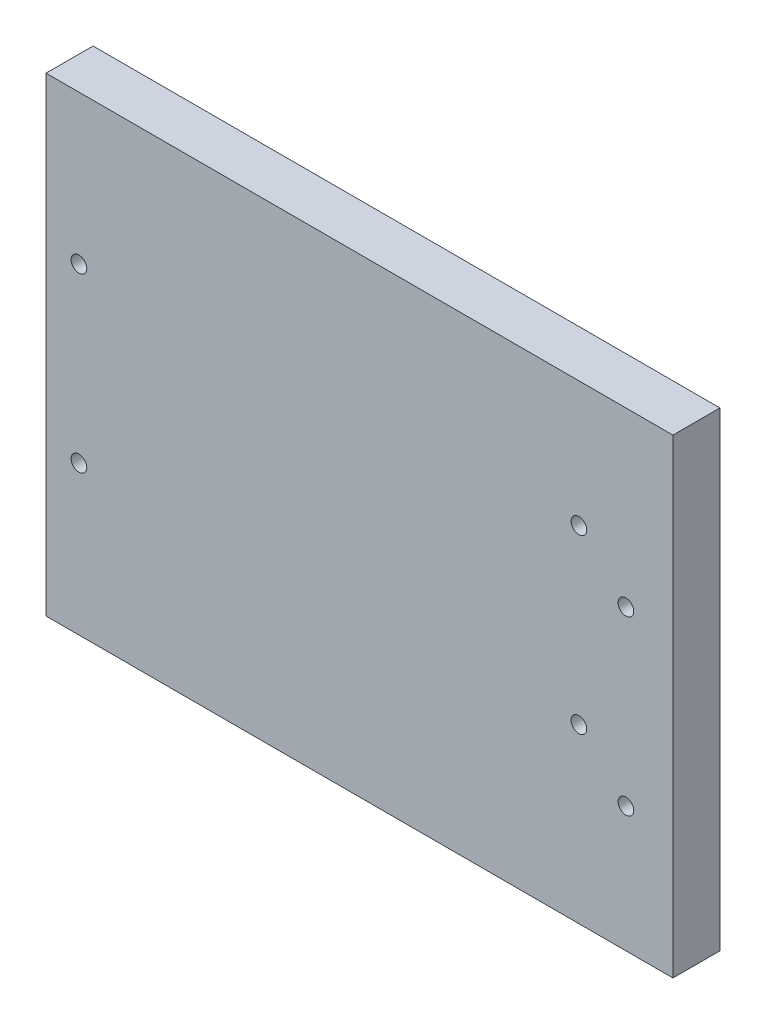
from build123d import *

# Parameters (mm, degrees)
SKETCH1_W           = 200
SKETCH1_H           = 150
BOSS_EXTRUDE1_DEPTH = 15
SKETCH2_R           = 2.5
CUT_EXTRUDE1_DEPTH  = 126.89678312
SKETCH3_R           = 5
CUT_EXTRUDE2_DEPTH  = 6


with BuildPart() as part:
    # Sketch1 → Boss-Extrude1 (new body)
    with BuildSketch(Plane.XY):
        Rectangle(SKETCH1_W, SKETCH1_H)
    extrude(amount=BOSS_EXTRUDE1_DEPTH)

    # Sketch2 → Cut-Extrude1 (cut, through all)
    with BuildSketch(Plane.XY.offset(15)):
        with Locations((85, -35)):
            Circle(SKETCH2_R)
        with Locations((70, -20)):
            Circle(SKETCH2_R)
        with Locations((85, 20)):
            Circle(SKETCH2_R)
        with Locations((70, 35)):
            Circle(SKETCH2_R)
        with Locations((-89.5, 27.5)):
            Circle(SKETCH2_R)
        with Locations((-89.5, -27.5)):
            Circle(SKETCH2_R)
    extrude(amount=-CUT_EXTRUDE1_DEPTH, mode=Mode.SUBTRACT)

    # Sketch3 → Cut-Extrude2 (cut)
    with BuildSketch(Plane(origin=(0, 0, 0), x_dir=(-1, 0, 0), z_dir=(0, 0, -1))):
        with Locations((-70, 35)):
            Circle(SKETCH3_R)
        with Locations((-85, 20)):
            Circle(SKETCH3_R)
        with Locations((-70, -20)):
            Circle(SKETCH3_R)
        with Locations((-85, -35)):
            Circle(SKETCH3_R)
        with Locations((89.5, -27.5)):
            Circle(SKETCH3_R)
        with Locations((89.5, 27.5)):
            Circle(SKETCH3_R)
    extrude(amount=-CUT_EXTRUDE2_DEPTH, mode=Mode.SUBTRACT)


solid = part.part
